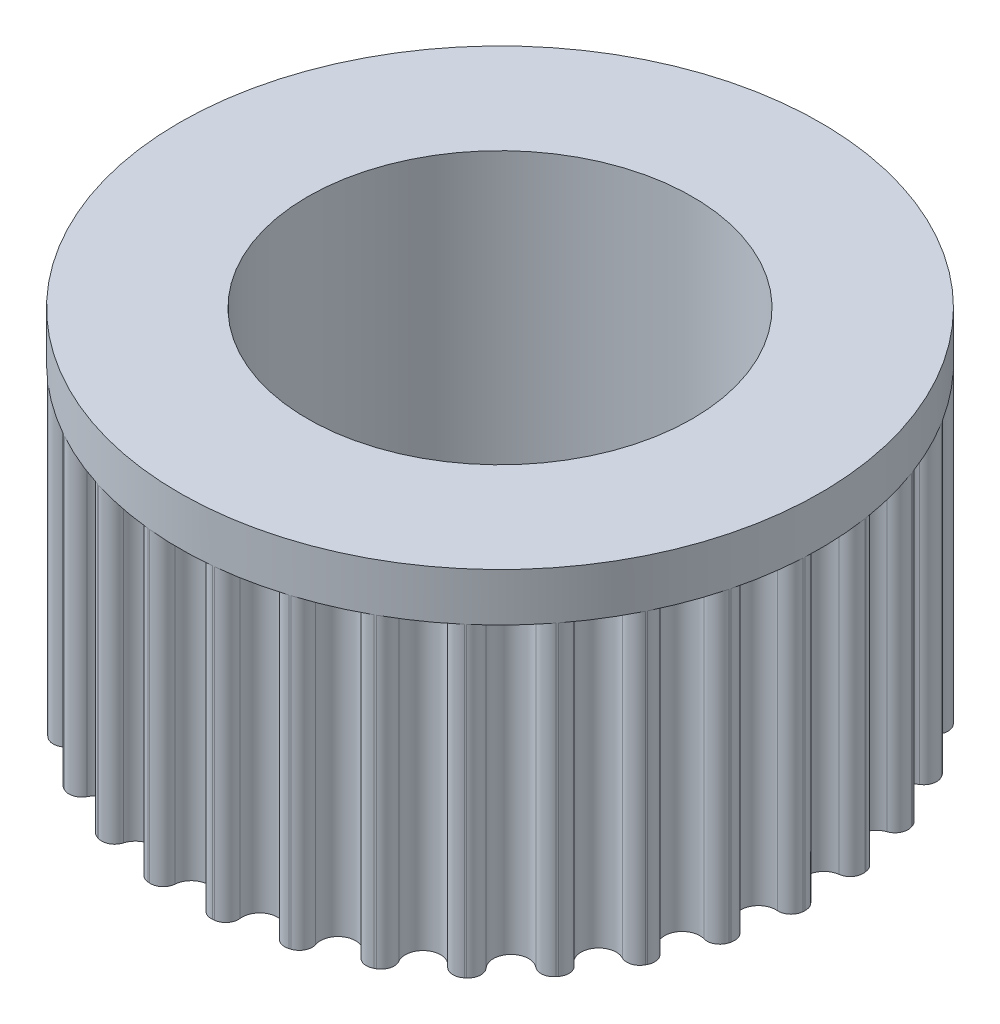
from build123d import *
from build123d.topology import SkipClean

# Parameters (mm, degrees)
CUT_EXTRUDE3_DEPTH  = 25
CIRPATTERN1_COUNT   = 31
SKETCH3_R           = 10
SKETCH3_R_2         = 6
BOSS_EXTRUDE1_DEPTH = 1.5


with BuildPart() as part:
    # Skica2 → Revolute (revolve)
    with BuildSketch(Plane.XY):
        Polygon((7.559396859, -4.775), (6, -4.775), (6, 4.775), (7.057473122, 4.775), (11, 4.775), (11, 3.775), (10, 3.775), (10, -3.775), (11, -3.775), (11, -4.775), align=None)
    revolve(axis=Axis((0, -9, 0), (0, 1, 0)))

    # Sketch2 → Cut-Extrude3 (cut, symmetric)
    with BuildSketch(Plane.XZ.offset(-3.775)):
        with BuildLine():
            ThreePointArc((-0.548328456, 9.584327619), (0, 9.077175079), (0.548328456, 9.584327619))
            ThreePointArc((0.548328456, 9.584327619), (0.690345524, 9.859875093), (0.98657582, 9.951214406))
            ThreePointArc((0.98657582, 9.951214406), (1.758150663, 9.844232131), (2.519057525, 9.677517718))
            ThreePointArc((2.519057525, 9.677517718), (1.780487447, 11.30131605), (0, 11.191446883))
            ThreePointArc((0, 11.191446883), (-1.780487447, 11.30131605), (-2.519057525, 9.677517718))
            ThreePointArc((-2.519057525, 9.677517718), (-1.758150663, 9.844232131), (-0.98657582, 9.951214406))
            ThreePointArc((-0.98657582, 9.951214406), (-0.690345524, 9.859875093), (-0.548328456, 9.584327619))
        make_face()
    cut_extrude3 = extrude(amount=CUT_EXTRUDE3_DEPTH, both=True, mode=Mode.SUBTRACT)

    # CirPattern1: Cut-Extrude3 ×31 about axis
    with SkipClean():  # the faces are left unmerged after this step: merging them gives an invalid solid
        cirpattern1_axis = Axis((0, 0, 0), (0, 1, 0))
        for i in range(1, CIRPATTERN1_COUNT):
            add(cut_extrude3.rotate(cirpattern1_axis, i * 360 / CIRPATTERN1_COUNT), mode=Mode.SUBTRACT)

    # Sketch3 → Boss-Extrude1 (add)
    with BuildSketch(Plane(origin=(0, 4.775, 0), x_dir=(1, 0, 0), z_dir=(0, 1, 0))):
        with Locations(Location((0, 0, 0), (0, 0, 357.241352483))):
            Circle(SKETCH3_R)
        Circle(SKETCH3_R_2, mode=Mode.SUBTRACT)
    extrude(amount=BOSS_EXTRUDE1_DEPTH)


solid = part.part
